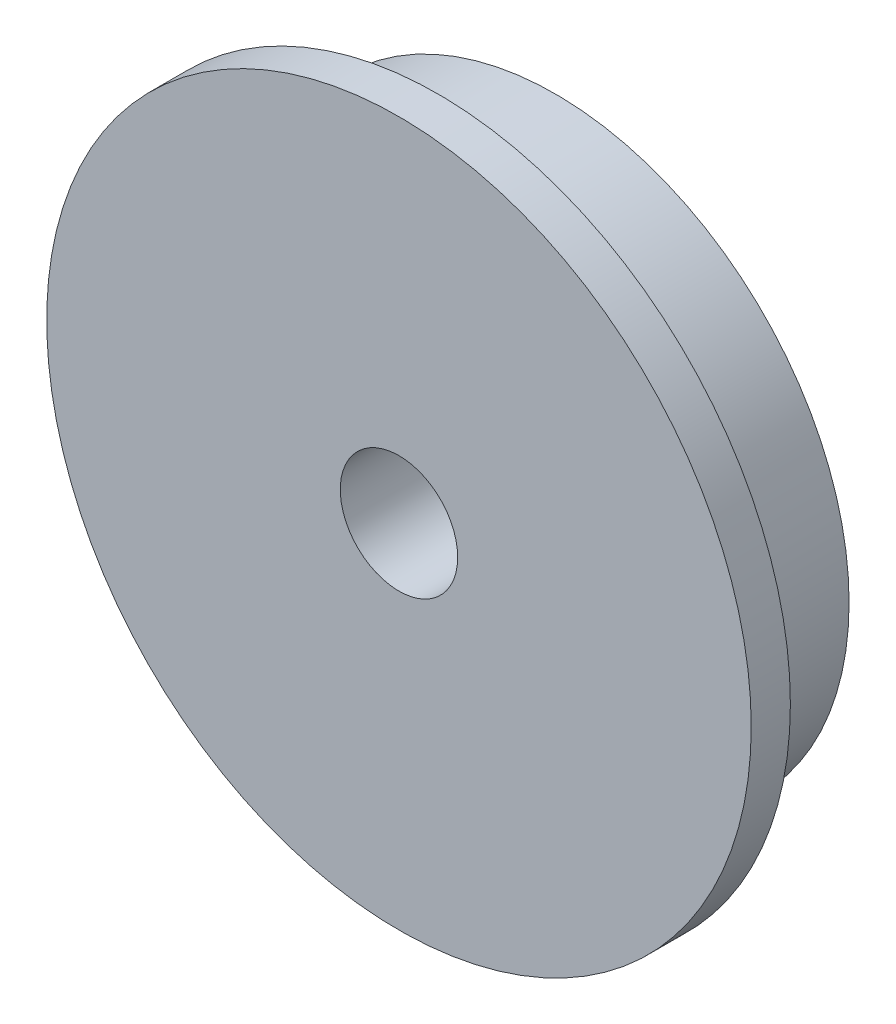
from build123d import *

# Parameters (mm, degrees)
SKETCH_1_R      = 15
SKETCH_1_R_2    = 3
EXTRUDE_1_DEPTH = 8
EXTRUDE_START   = -2
SKETCH_2_R      = 18
SKETCH_2_R_2    = 3
EXTRUDE_2_DEPTH = 2


with BuildPart() as part:
    # 草图1 → 凸台-拉伸1 (new body)
    with BuildSketch(Plane.XY):
        Circle(SKETCH_1_R)
        Circle(SKETCH_1_R_2, mode=Mode.SUBTRACT)
    extrude(amount=EXTRUDE_1_DEPTH)

    # 草图2 → 凸台-拉伸2 (add)
    with BuildSketch(Plane.XY.offset(8).offset(EXTRUDE_START)):
        Circle(SKETCH_2_R)
        Circle(SKETCH_2_R_2, mode=Mode.SUBTRACT)
    extrude(amount=EXTRUDE_2_DEPTH)


solid = part.part
